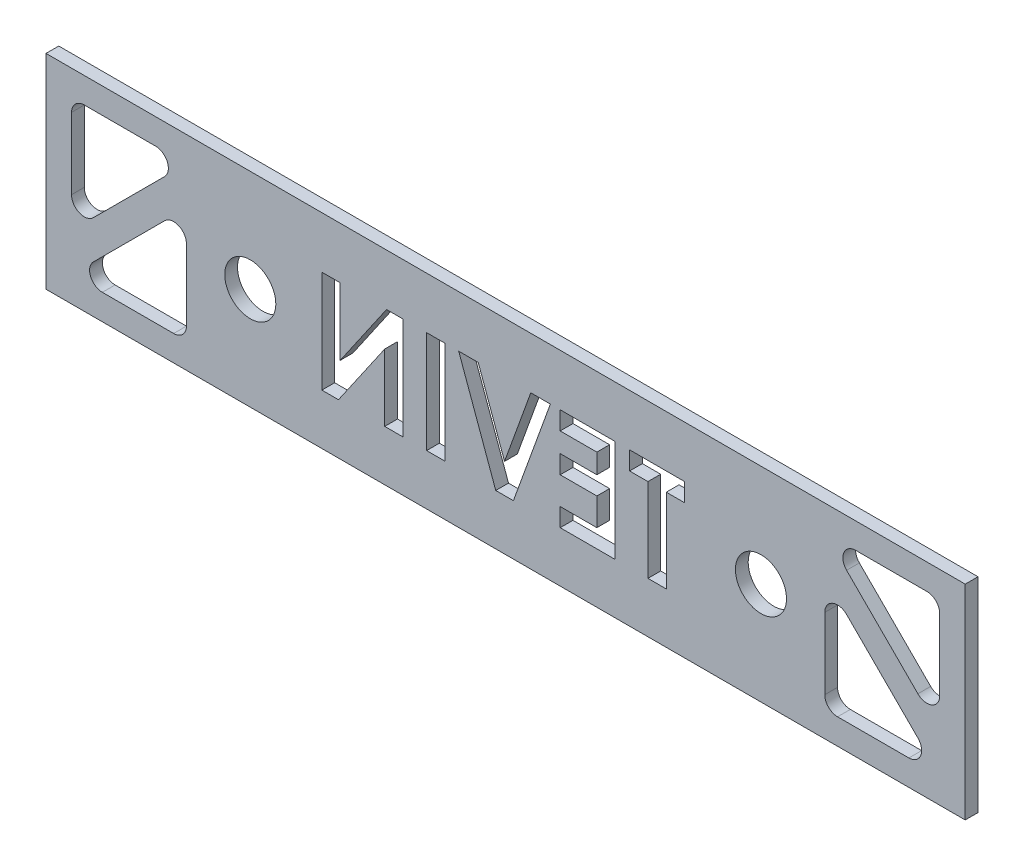
from build123d import *

# Parameters (mm, degrees)
SKETCH1_W           = 6.35
SKETCH1_H           = 101.6
BOSS_EXTRUDE1_DEPTH = 457.2
SKETCH2_R           = 12.7
CUT_EXTRUDE1_DEPTH  = 467.602190566
SKETCH3_W           = 9.117948718
SKETCH3_H           = 50.8
CUT_EXTRUDE2_DEPTH  = 467.602190566


with BuildPart() as part:
    # Sketch1 → Boss-Extrude1 (new body)
    with BuildSketch(Plane(origin=(0, 0, 0), x_dir=(0, 0, -1), z_dir=(1, 0, 0))):
        with Locations((1.913371748, -42.180867605)):
            Rectangle(SKETCH1_W, SKETCH1_H)
    extrude(amount=BOSS_EXTRUDE1_DEPTH)

    # Sketch2 → Cut-Extrude1 (cut, through all)
    with BuildSketch(Plane(origin=(0, 0, -5.088371748), x_dir=(-1, 0, 0), z_dir=(0, 0, -1))):
        with Locations(Location((-355.6, -42.180867605, 0), (0, 0, 90))):
            Circle(SKETCH2_R)
        with Locations(Location((-101.6, -42.180867605, 0), (0, 0, 90))):
            Circle(SKETCH2_R)
    extrude(amount=-CUT_EXTRUDE1_DEPTH, mode=Mode.SUBTRACT)

    # Sketch3 → Cut-Extrude2 (cut, through all)
    with BuildSketch(Plane(origin=(0, 0, -5.088371748), x_dir=(-1, 0, 0), z_dir=(0, 0, -1))):
        with BuildLine():
            Line((-438.15, -4.080867605), (-402.680256121, -4.080867605))
            ThreePointArc((-402.680256121, -4.080867605), (-396.81362109, -8.000827809), (-398.190128061, -14.920995665))
            Line((-398.190128061, -14.920995665), (-433.659871939, -50.390739544))
            ThreePointArc((-433.659871939, -50.390739544), (-440.580039796, -51.767246515), (-444.5, -45.900611484))
            Line((-444.5, -45.900611484), (-444.5, -10.430867605))
            ThreePointArc((-444.5, -10.430867605), (-442.640128061, -5.940739544), (-438.15, -4.080867605))
        make_face()
        with BuildLine():
            Line((-398.190128061, -33.970995665), (-433.659871939, -69.440739544))
            ThreePointArc((-433.659871939, -69.440739544), (-435.03637891, -76.3609074), (-429.169743879, -80.280867605))
            Line((-429.169743879, -80.280867605), (-393.7, -80.280867605))
            ThreePointArc((-393.7, -80.280867605), (-389.209871939, -78.420995665), (-387.35, -73.930867605))
            Line((-387.35, -73.930867605), (-387.35, -38.461123726))
            ThreePointArc((-387.35, -38.461123726), (-391.269960204, -32.594488694), (-398.190128061, -33.970995665))
        make_face()
        with BuildLine():
            Line((-69.85, -73.930867605), (-69.85, -38.461123726))
            ThreePointArc((-69.85, -38.461123726), (-65.930039796, -32.594488694), (-59.009871939, -33.970995665))
            Line((-59.009871939, -33.970995665), (-23.540128061, -69.440739544))
            ThreePointArc((-23.540128061, -69.440739544), (-22.16362109, -76.3609074), (-28.030256121, -80.280867605))
            Line((-28.030256121, -80.280867605), (-63.5, -80.280867605))
            ThreePointArc((-63.5, -80.280867605), (-67.990128061, -78.420995665), (-69.85, -73.930867605))
        make_face()
        with BuildLine():
            Line((-23.540128061, -50.390739544), (-59.009871939, -14.920995665))
            ThreePointArc((-59.009871939, -14.920995665), (-60.38637891, -8.000827809), (-54.519743879, -4.080867605))
            Line((-54.519743879, -4.080867605), (-19.05, -4.080867605))
            ThreePointArc((-19.05, -4.080867605), (-14.559871939, -5.940739544), (-12.7, -10.430867605))
            Line((-12.7, -10.430867605), (-12.7, -45.900611484))
            ThreePointArc((-12.7, -45.900611484), (-16.619960204, -51.767246515), (-23.540128061, -50.390739544))
        make_face()
        Polygon((-317.614703405, -17.01094408), (-290.260857251, -17.01094408), (-290.260857251, -26.128892798), (-299.378805969, -26.128892798), (-299.378805969, -67.81094408), (-308.496754687, -67.81094408), (-308.496754687, -26.128892798), (-317.614703405, -26.128892798), align=None)
        Polygon((-283.096754687, -17.01094408), (-255.742908533, -17.01094408), (-255.742908533, -26.128892798), (-273.978805969, -26.128892798), (-273.978805969, -35.898123567), (-255.742908533, -35.898123567), (-255.742908533, -45.016072285), (-273.978805969, -45.016072285), (-273.978805969, -58.692995362), (-255.742908533, -58.692995362), (-255.742908533, -67.81094408), (-283.096754687, -67.81094408), align=None)
        Polygon((-250.858293149, -17.01094408), (-241.119591226, -17.01094408), (-228.063421354, -53.096040233), (-214.976722636, -17.01094408), (-205.268549559, -17.01094408), (-223.687620072, -67.81094408), (-232.469751482, -67.81094408), align=None)
        with Locations((-193.871113661, -42.41094408)):
            Rectangle(SKETCH3_W, SKETCH3_H)
        Polygon((-177.589062379, -17.01094408), (-169.376802764, -17.01094408), (-146.327523918, -50.440030618), (-146.327523918, -17.01094408), (-137.2095752, -17.01094408), (-137.2095752, -67.81094408), (-145.482892508, -67.81094408), (-168.471113661, -34.483620362), (-168.471113661, -67.81094408), (-177.589062379, -67.81094408), align=None)
    extrude(amount=-CUT_EXTRUDE2_DEPTH, mode=Mode.SUBTRACT)


solid = part.part
